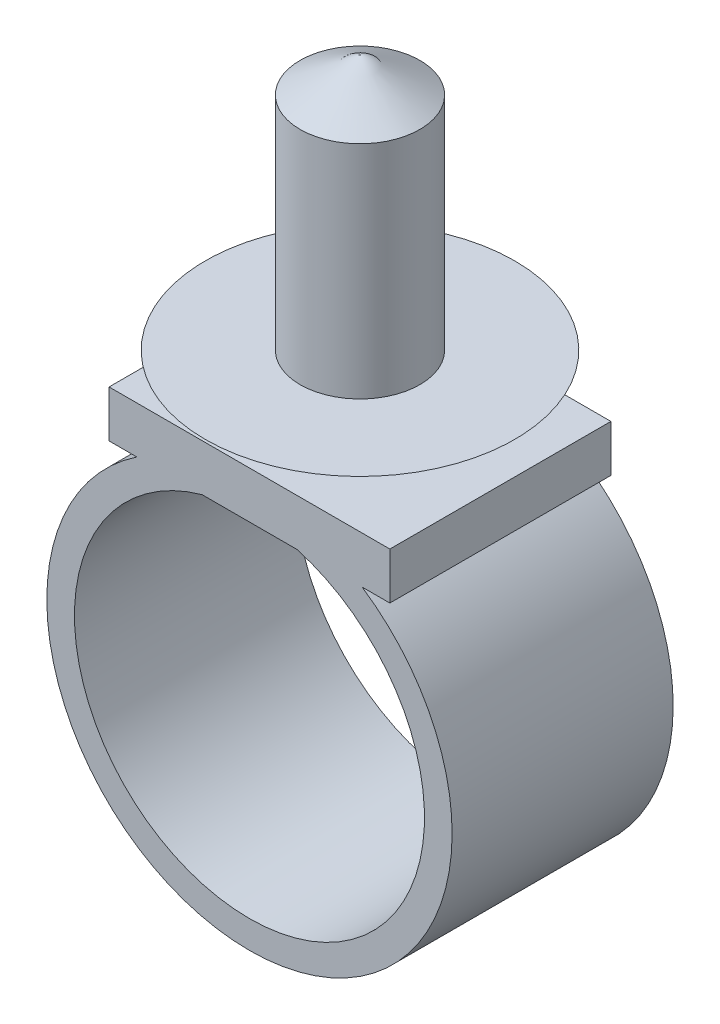
from build123d import *

# Parameters (mm, degrees)
SKETCH1_R           = 11
SKETCH1_R_2         = 9.5
BOSS_EXTRUDE1_DEPTH = 12
BOSS_EXTRUDE2_DEPTH = 2.54
SKETCH3_R           = 4
BOSS_EXTRUDE3_DEPTH = 2.54
BOSS_EXTRUDE3_DRAFT = -60
SKETCH4_R           = 3.25
BOSS_EXTRUDE4_DEPTH = 12


with BuildPart() as part:
    # Sketch1 → Boss-Extrude1 (new body)
    with BuildSketch(Plane.XY):
        Circle(SKETCH1_R)
        Circle(SKETCH1_R_2, mode=Mode.SUBTRACT)
    extrude(amount=BOSS_EXTRUDE1_DEPTH)

    # Sketch2 → Boss-Extrude2 (add)
    with BuildSketch(Plane(origin=(0, 9.144, 0), x_dir=(1, 0, 0), z_dir=(0, 1, 0))):
        Polygon((0, 0), (7.62, 0), (7.62, -12), (-7.62, -12), (-7.62, 0), align=None)
    extrude(amount=BOSS_EXTRUDE2_DEPTH)


with BuildPart() as boss_extrude3_tool:
    # Sketch3 → Boss-Extrude3 (with draft: the straight prism first)
    with BuildSketch(Plane(origin=(0, 11.684, 0), x_dir=(1, 0, 0), z_dir=(0, 1, 0))):
        with Locations((0, -6)):
            Circle(SKETCH3_R)
    extrude(amount=BOSS_EXTRUDE3_DEPTH)
    # Boss-Extrude3: the draft: its side faces are tilted about the plane it starts from
    boss_extrude3_sides = [boss_extrude3_tool.faces().sort_by_distance(p)[0] for p in [
        (-4, 12.954, 6),
    ]]
    draft(boss_extrude3_sides, Plane(origin=(0, 11.684, 0), x_dir=(1, 0, 0), z_dir=(0, 1, 0)), BOSS_EXTRUDE3_DRAFT)


with BuildPart() as part_1:
    add(part.part)

    # Boss-Extrude3: add boss_extrude3_tool
    add(boss_extrude3_tool.part)

    # Sketch4 → Boss-Extrude4 (add)
    with BuildSketch(Plane(origin=(0, 14.224, 0), x_dir=(1, 0, 0), z_dir=(0, 1, 0))):
        with Locations(Location((0, -6, 0), (0, 0, 270))):
            Circle(SKETCH4_R)
    extrude(amount=BOSS_EXTRUDE4_DEPTH)

    # Boss-Extrude5 cone 1 section (through the dimple's axis) → Boss-Extrude5 (revolve)
    with BuildSketch(Plane(origin=(0, 26.224, 6), x_dir=(0, 0, -1), z_dir=(1, 0, 0))):
        Polygon((0, 0), (3.25, 0), (0, 1.876388375), align=None)
    revolve(axis=Axis((0, 26.224, 6), (0, 1, 0)))


solid = part_1.part
